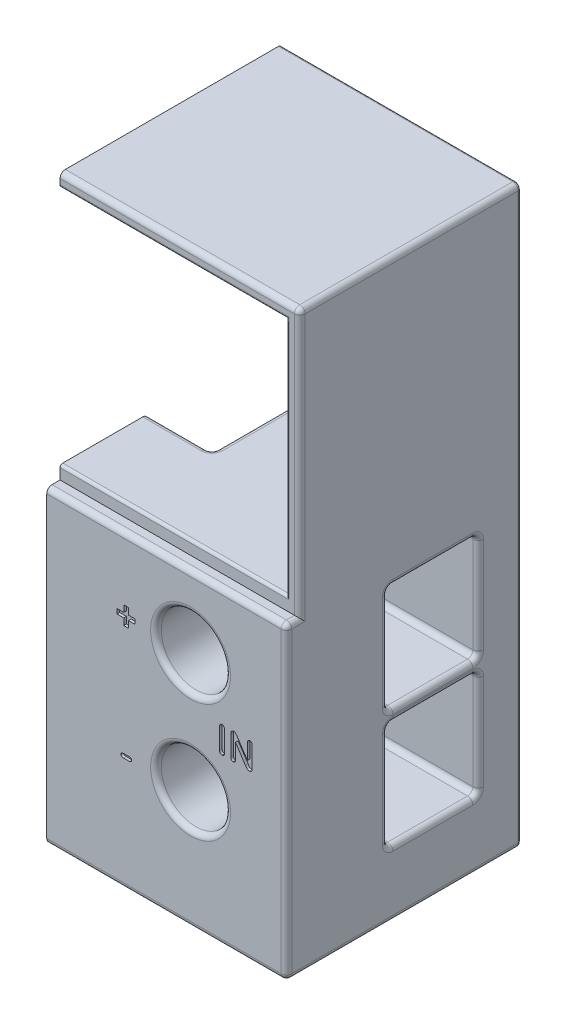
from build123d import *

# Parameters (mm, degrees)
SKETCH2_W               = 87.999717
SKETCH2_H               = 108
SKETCH2_R               = 6.5
SKETCH2_W_2             = 63.5
SKETCH2_H_2             = 21.25
BOSS_EXTRUDE1_DEPTH     = 46
SKETCH4_W               = 63.5
SKETCH4_H               = 21.25
BOSS_EXTRUDE2_DEPTH     = 44
BOSS_EXTRUDE3_START     = -10
SKETCH5_R               = 6.5
BOSS_EXTRUDE3_DEPTH     = 10
BOSS_EXTRUDE4_DEPTH     = 46
CUT_EXTRUDE1_START      = -45
SKETCH3_W               = 2
SKETCH3_H               = 20
CUT_EXTRUDE1_DEPTH      = 28
CUT_EXTRUDE2_START      = 45
SKETCH3_3_W             = 2
SKETCH3_3_H             = 20
CUT_EXTRUDE2_DEPTH      = 28
SKETCH6_W               = 85
SKETCH6_H               = 45
SKETCH6_W_2             = 63.5
SKETCH6_H_2             = 21.25
CUT_EXTRUDE4_DEPTH      = 85.00595217
SKETCH8_R               = 4.25
CUT_EXTRUDE5_DEPTH      = 79.974679487
SKETCH9_W               = 85
SKETCH9_H               = 103
CUT_EXTRUDE6_DEPTH      = 8
SKETCH6_4_W             = 90
SKETCH6_4_H             = 50
SKETCH6_4_W_2           = 85
SKETCH6_4_H_2           = 45
CUT_EXTRUDE7_DEPTH      = 2.5
CUT_EXTRUDE8_DEPTH      = 85.00595217
CUT_EXTRUDE8_DEPTH_BACK = 85.00595217
SKETCH10_W              = 2
SKETCH10_H              = 108
FILLET2_R               = 1
FILLET3_R               = 0.5
SKETCH11_W              = 24
SKETCH11_H              = 58
CUT_EXTRUDE9_DEPTH      = 19
FILLET4_R               = 1
CUT_EXTRUDE10_DEPTH     = 0.5
SKETCH13_W              = 45
SKETCH13_H              = 108
CUT_EXTRUDE12_DEPTH     = 83.927679336


with BuildPart() as part:
    # Sketch2 → Boss-Extrude1 (new body)
    with BuildSketch(Plane.XY):
        Rectangle(SKETCH2_W, SKETCH2_H)
        with Locations((-27, -9.375)):
            Circle(SKETCH2_R, mode=Mode.SUBTRACT)
        with Locations((27, -9.375)):
            Circle(SKETCH2_R, mode=Mode.SUBTRACT)
        with Locations((27, -31.625)):
            Circle(SKETCH2_R, mode=Mode.SUBTRACT)
        with Locations((-27, -31.625)):
            Circle(SKETCH2_R, mode=Mode.SUBTRACT)
        with Locations((0, 32.5)):
            Rectangle(SKETCH2_W_2, SKETCH2_H_2, mode=Mode.SUBTRACT)
    extrude(amount=-BOSS_EXTRUDE1_DEPTH)

    # Sketch4 → Boss-Extrude2 (add)
    with BuildSketch(Plane(origin=(0, 0, -46), x_dir=(-1, 0, 0), z_dir=(0, 0, -1))):
        with Locations((0, 32.5)):
            Rectangle(SKETCH4_W, SKETCH4_H)
    extrude(amount=-BOSS_EXTRUDE2_DEPTH)

    # Sketch5 → Boss-Extrude3 (add)
    with BuildSketch(Plane(origin=(0, 0, -46), x_dir=(-1, 0, 0), z_dir=(0, 0, -1)).offset(BOSS_EXTRUDE3_START)):
        with Locations(Location((-27, -9.375, 0), (0, 0, 180))):
            Circle(SKETCH5_R)
        with Locations(Location((-27, -31.625, 0), (0, 0, 180))):
            Circle(SKETCH5_R)
        with Locations(Location((27, -31.625, 0), (0, 0, 180))):
            Circle(SKETCH5_R)
        with Locations(Location((27, -9.375, 0), (0, 0, 180))):
            Circle(SKETCH5_R)
    extrude(amount=BOSS_EXTRUDE3_DEPTH)

    # Sketch7 → Boss-Extrude4 (add)
    with BuildSketch(Plane.XY):
        Polygon((45, 54), (43.9998585, 52.7998302), (43.9998585, -54), (45, -54), align=None)
        Polygon((-45, 54), (-45, -54), (-43.9998585, -52.7998302), (-43.9998585, 54), align=None)
        Polygon((43.9998585, 54), (43.9998585, 52.7998302), (45, 54), align=None)
        Polygon((-43.9998585, -52.7998302), (-45, -54), (-43.9998585, -54), align=None)
    extrude(amount=-BOSS_EXTRUDE4_DEPTH)

    # Sketch3 → Cut-Extrude1 (cut)
    with BuildSketch(Plane(origin=(0, 0, 0), x_dir=(0, 0, -1), z_dir=(1, 0, 0)).offset(CUT_EXTRUDE1_START)):
        with BuildLine():
            Line((34, -1.125), (34, 0.625))
            Line((34, 0.625), (19, 0.625))
            Line((19, 0.625), (19, -19.375))
            Line((19, -19.375), (34, -19.375))
            Line((34, -19.375), (34, -17.625))
            ThreePointArc((34, -17.625), (27.5, -9.375), (34, -1.125))
        make_face()
        with Locations((35, -9.375)):
            Rectangle(SKETCH3_W, SKETCH3_H)
        with BuildLine():
            Line((34, -21.625), (19, -21.625))
            Line((19, -21.625), (19, -41.625))
            Line((19, -41.625), (34, -41.625))
            Line((34, -41.625), (34, -39.875))
            ThreePointArc((34, -39.875), (27.5, -31.625), (34, -23.375))
            Line((34, -23.375), (34, -21.625))
        make_face()
        with BuildLine():
            Line((34, -39.875), (34, -23.375))
            ThreePointArc((34, -23.375), (27.5, -31.625), (34, -39.875))
        make_face()
        with Locations((35, -31.625)):
            Rectangle(SKETCH3_W, SKETCH3_H)
        with BuildLine():
            Line((34, -17.625), (34, -1.125))
            ThreePointArc((34, -1.125), (27.5, -9.375), (34, -17.625))
        make_face()
    extrude(amount=CUT_EXTRUDE1_DEPTH, mode=Mode.SUBTRACT)

    # Sketch3<3> → Cut-Extrude2 (cut)
    with BuildSketch(Plane(origin=(0, 0, 0), x_dir=(0, 0, -1), z_dir=(1, 0, 0)).offset(CUT_EXTRUDE2_START)):
        with BuildLine():
            Line((34, -1.125), (34, 0.625))
            Line((34, 0.625), (19, 0.625))
            Line((19, 0.625), (19, -19.375))
            Line((19, -19.375), (34, -19.375))
            Line((34, -19.375), (34, -17.625))
            ThreePointArc((34, -17.625), (27.5, -9.375), (34, -1.125))
        make_face()
        with BuildLine():
            Line((34, -17.625), (34, -1.125))
            ThreePointArc((34, -1.125), (27.5, -9.375), (34, -17.625))
        make_face()
        with Locations((35, -9.375)):
            Rectangle(SKETCH3_3_W, SKETCH3_3_H)
        with Locations((35, -31.625)):
            Rectangle(SKETCH3_3_W, SKETCH3_3_H)
        with BuildLine():
            Line((34, -39.875), (34, -23.375))
            ThreePointArc((34, -23.375), (27.5, -31.625), (34, -39.875))
        make_face()
        with BuildLine():
            Line((34, -21.625), (19, -21.625))
            Line((19, -21.625), (19, -41.625))
            Line((19, -41.625), (34, -41.625))
            Line((34, -41.625), (34, -39.875))
            ThreePointArc((34, -39.875), (27.5, -31.625), (34, -23.375))
            Line((34, -23.375), (34, -21.625))
        make_face()
    extrude(amount=-CUT_EXTRUDE2_DEPTH, mode=Mode.SUBTRACT)

    # Sketch6 → Cut-Extrude4 (cut, through all)
    # profile 1 of 2: a face of its own
    with BuildSketch(Plane.XY):
        with Locations((0, 29)):
            Rectangle(SKETCH6_W, SKETCH6_H)
        with Locations((0, 32.5)):
            Rectangle(SKETCH6_W_2, SKETCH6_H_2, mode=Mode.SUBTRACT)
    # profile 2 of 2: a face of its own
    with BuildSketch(Plane.XY):
        with Locations((0, 32.5)):
            Rectangle(SKETCH6_W_2, SKETCH6_H_2)
    extrude(amount=-CUT_EXTRUDE4_DEPTH, mode=Mode.SUBTRACT)

    # Sketch8 → Cut-Extrude5 (cut, through all)
    with BuildSketch(Plane.XY.offset(-36)):
        with Locations((-27, -9.375)):
            Circle(SKETCH8_R)
        with Locations((-27, -31.625)):
            Circle(SKETCH8_R)
        with Locations((27, -31.625)):
            Circle(SKETCH8_R)
        with Locations((27, -9.375)):
            Circle(SKETCH8_R)
    extrude(amount=-CUT_EXTRUDE5_DEPTH, mode=Mode.SUBTRACT)

    # Sketch9 → Cut-Extrude6 (cut)
    with BuildSketch(Plane(origin=(0, 0, -46), x_dir=(-1, 0, 0), z_dir=(0, 0, -1))):
        Rectangle(SKETCH9_W, SKETCH9_H)
    extrude(amount=-CUT_EXTRUDE6_DEPTH, mode=Mode.SUBTRACT)

    # Sketch6<4> → Cut-Extrude7 (cut)
    with BuildSketch(Plane.XY):
        with Locations((0, 29)):
            Rectangle(SKETCH6_4_W, SKETCH6_4_H)
        with Locations((0, 29)):
            Rectangle(SKETCH6_4_W_2, SKETCH6_4_H_2, mode=Mode.SUBTRACT)
    extrude(amount=-CUT_EXTRUDE7_DEPTH, mode=Mode.SUBTRACT)

    # Sketch10 → Cut-Extrude8 (cut, two sides: drawn at the far end of the back side and taken through both)
    with BuildSketch(Plane(origin=(0, 0, 0), x_dir=(0, 0, -1), z_dir=(1, 0, 0)).offset(-CUT_EXTRUDE8_DEPTH_BACK)):
        with Locations((45, 0)):
            Rectangle(SKETCH10_W, SKETCH10_H)
    extrude(amount=CUT_EXTRUDE8_DEPTH + CUT_EXTRUDE8_DEPTH_BACK, mode=Mode.SUBTRACT)

    # Fillet2
    fillet2_edges = [part.edges().sort_by_distance(p)[0] for p in [
        (-17, -31.625, -19),
        (-31, -21.625, -19),
        (-33.5, -31.625, -19),
        (-17, -31.625, -36),
        (-31, -41.625, -36),
        (-17, -41.625, -27.5),
        (-31, -41.625, -19),
        (-45, -21.625, -27.5),
        (-31, -21.625, -36),
        (-17, -21.625, -27.5),
        (-45, -31.625, -19),
        (-45, -31.625, -36),
        (-45, -41.625, -27.5),
        (-45, -9.375, -19),
        (-31, 0.625, -19),
        (-45, -9.375, -36),
        (-31, -19.375, -36),
        (-33.5, -9.375, -19),
        (-17, -19.375, -27.5),
        (-31, -19.375, -19),
        (-45, 0.625, -27.5),
        (-31, 0.625, -36),
        (-17, -9.375, -19),
        (-17, -9.375, -36),
        (-17, 0.625, -27.5),
        (-45, -19.375, -27.5),
        (45, -9.375, -36),
        (31, 0.625, -36),
        (45, -9.375, -19),
        (31, -19.375, -19),
        (17, -19.375, -27.5),
        (31, -19.375, -36),
        (20.5, -9.375, -19),
        (45, 0.625, -27.5),
        (31, 0.625, -19),
        (17, -9.375, -36),
        (17, -9.375, -19),
        (17, 0.625, -27.5),
        (45, -19.375, -27.5),
        (17, -31.625, -19),
        (31, -41.625, -19),
        (20.5, -31.625, -19),
        (17, -31.625, -36),
        (31, -21.625, -36),
        (45, -41.625, -27.5),
        (31, -41.625, -36),
        (17, -21.625, -27.5),
        (31, -21.625, -19),
        (17, -41.625, -27.5),
        (45, -31.625, -36),
        (45, -21.625, -27.5),
        (45, -31.625, -19),
        (0, -54, 0),
        (22.75, -9.375, -36),
        (20.5, -31.625, 0),
        (22.75, -31.625, -36),
        (-31.25, -31.625, -36),
        (-31.25, -9.375, -36),
        (20.5, -9.375, 0),
        (-33.5, -31.625, 0),
        (-33.5, -9.375, 0),
        (0, 6.5, -38),
        (-45, -25, 0),
        (45, -25, 0),
        (-45, 29, -2.5),
        (-45, 4, -1.25),
        (0, 54, -2.5),
        (45, 29, -2.5),
        (45, 4, -1.25),
        (0, 4, 0),
        (-45, -54, -22),
        (45, -54, -22),
        (-45, 54, -23.25),
        (45, 54, -23.25),
    ]]
    fillet(fillet2_edges, radius=FILLET2_R)

    # Fillet3
    fillet3_edges = [part.edges().sort_by_distance(p)[0] for p in [
        (22.75, -31.625, -38),
        (22.75, -9.375, -38),
        (-31.25, -9.375, -38),
        (-31.25, -31.625, -38),
        (0, 51.5, -2.5),
        (-42.5, 29, -2.5),
        (0, 6.5, -2.5),
        (42.5, 29, -2.5),
        (0, -51.5, -44),
        (42.5, 0, -44),
        (0, 51.5, -44),
        (-42.5, 0, -44),
        (-45, 0, -44),
        (45, 0, -44),
        (0, -54, -44),
        (0, 54, -44),
        (44.707106781, 53.707106781, -44),
        (-44.707106781, 53.707106781, -44),
        (-44.707106781, -53.707106781, -44),
        (44.707106781, -53.707106781, -44),
    ]]
    fillet(fillet3_edges, radius=FILLET3_R)

    # Sketch11 → Cut-Extrude9 (cut)
    with BuildSketch(Plane(origin=(0, 0, -38), x_dir=(-1, 0, 0), z_dir=(0, 0, -1))):
        with Locations((0, -22.5)):
            Rectangle(SKETCH11_W, SKETCH11_H)
    extrude(amount=-CUT_EXTRUDE9_DEPTH, mode=Mode.SUBTRACT)

    # Fillet4
    fillet4_edges = [part.edges().sort_by_distance(p)[0] for p in [
        (12, 6.207106781, -37.707106781),
        (-12, 6.207106781, -37.707106781),
        (-12, -23, -38),
        (12, -23, -38),
        (-12, 6.5, -28),
        (12, 6.5, -28),
        (-12, -22.5, -19),
        (0, -51.5, -19),
        (12, -22.5, -19),
        (0, 6.5, -19),
    ]]
    fillet(fillet4_edges, radius=FILLET4_R)

    # Sketch12 → Cut-Extrude10 (cut)
    # profile 1 of 9: a face of its own
    with BuildSketch(Plane.XY):
        with BuildLine():
            add(Edge.make_bspline(
                [(-40.204101563, -18.0625), (-40.142219014, -18.063368709), (-40.020879099, -18.065072082), (-39.842278019, -18.0805127), (-39.670025809, -18.103431299), (-39.504239086, -18.136420072), (-39.345329126, -18.179465633), (-39.193265668, -18.232369375), (-39.047852761, -18.294956068), (-38.908920342, -18.365997783), (-38.77799459, -18.446416769), (-38.654241911, -18.534359089), (-38.539064026, -18.631114909), (-38.43219245, -18.735834907), (-38.334309043, -18.848804815), (-38.243990785, -18.969397378), (-38.161933411, -19.098290949), (-38.089020705, -19.23545814), (-38.023513565, -19.378849399), (-37.966648985, -19.528884986), (-37.919187553, -19.684929266), (-37.879709879, -19.847240726), (-37.849789796, -20.015581804), (-37.828714559, -20.190346757), (-37.81412411, -20.370846257), (-37.813046628, -20.493459783), (-37.8125, -20.555664063)],
                knots=[0, 0, 0, 0, 1.137132438, 2.22970057, 3.292424762, 4.329649132, 5.333981859, 6.315987487, 7.286185149, 8.241436353, 9.181332131, 10.107725602, 11.0292572, 11.943085262, 12.854854597, 13.773819033, 14.709898734, 15.660115542, 16.626635295, 17.605574315, 18.606712189, 19.622473761, 20.67399022, 21.747038223, 22.857027702, 24, 24, 24, 24], degree=3))
            add(Edge.make_bspline(
                [(-37.8125, -20.555664063), (-37.814407642, -20.646879139), (-37.818150658, -20.825853777), (-37.846542647, -21.087869401), (-37.894672643, -21.337285549), (-37.96022212, -21.574001048), (-38.046378281, -21.796377097), (-38.151196568, -22.00412166), (-38.275708195, -22.196231979), (-38.418571732, -22.372534386), (-38.57924091, -22.5320302), (-38.758813404, -22.671073825), (-38.956175636, -22.789747841), (-39.169574475, -22.889709328), (-39.400288076, -22.968467406), (-39.647849295, -23.021416856), (-39.910729065, -23.057454879), (-40.09166815, -23.060788415), (-40.184570313, -23.0625)],
                knots=[0, 0, 0, 0, 1.119700056, 2.196982321, 3.230778928, 4.235358115, 5.208318876, 6.153781848, 7.087131445, 8.013361148, 8.934611457, 9.860297843, 10.794468433, 11.756326826, 12.748403726, 13.780058436, 14.860183413, 16, 16, 16, 16], degree=3))
            add(Edge.make_bspline(
                [(-40.184570313, -23.0625), (-40.276803124, -23.06027942), (-40.457365589, -23.055932231), (-40.720582827, -23.021097135), (-40.969461773, -22.965059913), (-41.20258146, -22.884937151), (-41.418313513, -22.78290435), (-41.617562497, -22.664138614), (-41.796462748, -22.523837845), (-41.957312206, -22.366006832), (-42.100098053, -22.190396648), (-42.221488428, -21.996136894), (-42.328544833, -21.787455566), (-42.413165738, -21.561257329), (-42.480490707, -21.32244949), (-42.5279401, -21.072812122), (-42.556870777, -20.813835192), (-42.56060378, -20.638096536), (-42.5625, -20.548828125)],
                knots=[0, 0, 0, 0, 1.130091603, 2.212359386, 3.247930852, 4.252250901, 5.226719473, 6.16821431, 7.089197795, 8.00610207, 8.925165125, 9.855999165, 10.808795857, 11.79501972, 12.810514548, 13.846493258, 14.906102224, 16, 16, 16, 16], degree=3))
            add(Edge.make_bspline(
                [(-42.5625, -20.548828125), (-42.560779931, -20.457917793), (-42.557397661, -20.279155552), (-42.52617064, -20.017250939), (-42.476867474, -19.76650569), (-42.406593898, -19.528182138), (-42.317493046, -19.303954514), (-42.20934334, -19.096268157), (-42.084128705, -18.905766816), (-41.941020547, -18.732813051), (-41.779791607, -18.578459843), (-41.601343885, -18.443470626), (-41.406555768, -18.327351299), (-41.195418304, -18.231841316), (-40.968892091, -18.155181952), (-40.727036042, -18.101058131), (-40.470304863, -18.068269124), (-40.294370818, -18.064456304), (-40.204101563, -18.0625)],
                knots=[0, 0, 0, 0, 1.125218611, 2.212582392, 3.260701818, 4.286054269, 5.284468473, 6.243521648, 7.180287843, 8.101949555, 9.017004541, 9.937572836, 10.866572707, 11.818894766, 12.801573564, 13.82236102, 14.882684417, 16, 16, 16, 16], degree=3))
        make_face()
        with BuildLine():
            add(Edge.make_bspline(
                [(-38.8125, -20.548828125), (-38.814409711, -20.461806319), (-38.818107355, -20.293311934), (-38.850878723, -20.049572404), (-38.903958219, -19.823491976), (-38.967222357, -19.648437478), (-39.027971578, -19.51867883), (-39.077585349, -19.428366426), (-39.130955162, -19.343341598), (-39.191528722, -19.266437061), (-39.254362066, -19.193984208), (-39.322390378, -19.127691549), (-39.395732164, -19.068546163), (-39.498508546, -18.996758293), (-39.636913927, -18.922373447), (-39.815617192, -18.858633433), (-40.006108222, -18.819354309), (-40.137179526, -18.814816767), (-40.204101563, -18.8125)],
                knots=[0, 0, 0, 0, 1.663767962, 3.22144036, 4.693807908, 6.09809827, 6.772124886, 7.43249818, 8.068074837, 8.689496673, 9.30272399, 9.901527182, 10.503429657, 11.102750509, 12.297797107, 13.495176895, 14.721094103, 16, 16, 16, 16], degree=3))
            add(Edge.make_bspline(
                [(-40.204101563, -18.8125), (-40.252038776, -18.813692449), (-40.346782105, -18.816049209), (-40.485861893, -18.838431131), (-40.619461179, -18.87343406), (-40.746958383, -18.922391316), (-40.86721804, -18.984912243), (-40.979702156, -19.060816842), (-41.083054339, -19.149809619), (-41.177853092, -19.25153021), (-41.263531901, -19.367003595), (-41.339544956, -19.497427585), (-41.40577496, -19.642803935), (-41.462238579, -19.801835484), (-41.506895778, -19.973704465), (-41.538649307, -20.156608918), (-41.558596828, -20.349495293), (-41.561179593, -20.481395653), (-41.5625, -20.548828125)],
                knots=[0, 0, 0, 0, 0.926902171, 1.831933723, 2.71800685, 3.595261319, 4.468550136, 5.334998465, 6.214894287, 7.1017058, 8.020008637, 8.99111482, 10.01694856, 11.106630737, 12.25237115, 13.448355624, 14.695502513, 16, 16, 16, 16], degree=3))
            add(Edge.make_bspline(
                [(-41.5625, -20.548828125), (-41.561175948, -20.616910417), (-41.558585554, -20.750107531), (-41.538678745, -20.94495126), (-41.506717933, -21.130076126), (-41.462379635, -21.304715937), (-41.405018449, -21.466834698), (-41.336159513, -21.614946915), (-41.258965571, -21.750109054), (-41.167899319, -21.868552345), (-41.069532555, -21.973072777), (-40.963817326, -22.06410939), (-40.851516456, -22.141662991), (-40.731554552, -22.204799085), (-40.604589267, -22.252170855), (-40.472024127, -22.288072541), (-40.332998529, -22.308578568), (-40.238345748, -22.311182043), (-40.190429688, -22.3125)],
                knots=[0, 0, 0, 0, 1.300369924, 2.54406124, 3.737115199, 4.88637188, 5.981883645, 7.016846829, 8.003376514, 8.948590554, 9.863559023, 10.741055788, 11.608647785, 12.46534091, 13.323432129, 14.192248925, 15.0848625, 16, 16, 16, 16], degree=3))
            add(Edge.make_bspline(
                [(-40.190429688, -22.3125), (-40.128714879, -22.310432989), (-40.007115757, -22.306360277), (-39.829062488, -22.268333598), (-39.65894479, -22.208545464), (-39.524248456, -22.139704674), (-39.422731166, -22.071892244), (-39.349371171, -22.014681888), (-39.281172171, -21.949579237), (-39.216166088, -21.879097392), (-39.155929432, -21.801699497), (-39.098897641, -21.718367101), (-39.046241602, -21.628209325), (-38.997525615, -21.53173024), (-38.95353172, -21.42910536), (-38.915158866, -21.320607226), (-38.884568811, -21.205758865), (-38.857870644, -21.085626874), (-38.837560064, -20.959421065), (-38.823117244, -20.827745953), (-38.814067885, -20.690231108), (-38.81303074, -20.596694032), (-38.8125, -20.548828125)],
                knots=[0, 0, 0, 0, 1.468568495, 2.893578421, 4.316075305, 5.755382189, 6.482330971, 7.222315454, 7.968369796, 8.725783183, 9.504530818, 10.302500265, 11.129737207, 11.9897977, 12.875655565, 13.787998707, 14.728608307, 15.705132475, 16.718642732, 17.771954593, 18.859838044, 20, 20, 20, 20], degree=3))
        make_face(mode=Mode.SUBTRACT)
    # profile 2 of 9: a face of its own
    with BuildSketch(Plane.XY):
        with BuildLine():
            Line((-36.9375, -20.981445313), (-36.9375, -18.65625))
            add(Edge.make_bspline(
                [(-36.9375, -18.65625), (-36.936347915, -18.609560537), (-36.934186191, -18.521954458), (-36.909347602, -18.399701183), (-36.870478375, -18.295100271), (-36.81330714, -18.209823291), (-36.743514772, -18.143210616), (-36.661901868, -18.096558932), (-36.571075194, -18.066512432), (-36.506755039, -18.06386389), (-36.473632813, -18.0625)],
                knots=[0, 0, 0, 0, 1.314006093, 2.465543923, 3.499702682, 4.438645347, 5.334276599, 6.193453487, 7.069703068, 8, 8, 8, 8], degree=3))
            add(Edge.make_bspline(
                [(-36.473632813, -18.0625), (-36.438939423, -18.064363054), (-36.372286212, -18.067942368), (-36.277450995, -18.095840638), (-36.194605213, -18.143871779), (-36.123835804, -18.210848219), (-36.067342536, -18.296948281), (-36.027775176, -18.402193177), (-36.003534117, -18.525270354), (-36.001222859, -18.613483661), (-36, -18.66015625)],
                knots=[0, 0, 0, 0, 0.96282878, 1.849794185, 2.716851436, 3.599658085, 4.532680285, 5.552030856, 6.704809248, 8, 8, 8, 8], degree=3))
            Line((-36, -18.66015625), (-36, -21.053710938))
            add(Edge.make_bspline(
                [(-36, -21.053710938), (-35.99889066, -21.119176272), (-35.996767426, -21.244474345), (-35.980352355, -21.424389171), (-35.952620356, -21.587521133), (-35.913468807, -21.734879035), (-35.858654871, -21.866513437), (-35.785781742, -21.982442862), (-35.694423845, -22.082436057), (-35.604389303, -22.152348162), (-35.523320188, -22.198607116), (-35.455881093, -22.22899436), (-35.38297238, -22.255675736), (-35.303537405, -22.275251537), (-35.21924944, -22.292442399), (-35.128794967, -22.303466192), (-35.032714084, -22.312002141), (-34.966492651, -22.312331511), (-34.932617188, -22.3125)],
                knots=[0, 0, 0, 0, 1.640841622, 3.140506311, 4.523579023, 5.784571649, 6.954579444, 8.084197464, 9.198982671, 10.333306227, 10.925380769, 11.535182691, 12.185613052, 12.868404783, 13.583722754, 14.340779317, 15.151228418, 16, 16, 16, 16], degree=3))
            add(Edge.make_bspline(
                [(-34.932617188, -22.3125), (-34.886018292, -22.311674313), (-34.796154634, -22.310082015), (-34.666915353, -22.294831437), (-34.547810982, -22.27254376), (-34.439976213, -22.237904472), (-34.342004443, -22.195029342), (-34.254772573, -22.142425249), (-34.177901824, -22.079862251), (-34.111987738, -22.006889167), (-34.056360614, -21.923270422), (-34.007144985, -21.831202928), (-33.966579922, -21.728768874), (-33.932253732, -21.61717405), (-33.906095076, -21.495290392), (-33.887966427, -21.363741724), (-33.877290695, -21.222181646), (-33.875781426, -21.124693418), (-33.875, -21.07421875)],
                knots=[0, 0, 0, 0, 1.187087794, 2.289239917, 3.312641325, 4.270309596, 5.169103343, 6.032749862, 6.858132282, 7.686303516, 8.528484611, 9.411791075, 10.342302716, 11.33164497, 12.384483705, 13.515514569, 14.713654137, 16, 16, 16, 16], degree=3))
            Line((-33.875, -21.07421875), (-33.875, -18.66015625))
            add(Edge.make_bspline(
                [(-33.875, -18.66015625), (-33.873685282, -18.612853927), (-33.871218239, -18.524091977), (-33.848475161, -18.400133957), (-33.808724112, -18.295398446), (-33.752835216, -18.209945927), (-33.683718699, -18.142612396), (-33.601499713, -18.096857609), (-33.509937038, -18.066252371), (-33.444926434, -18.063783409), (-33.411132813, -18.0625)],
                knots=[0, 0, 0, 0, 1.324209478, 2.484855026, 3.512713035, 4.440887327, 5.324452051, 6.186293477, 7.057204391, 8, 8, 8, 8], degree=3))
            add(Edge.make_bspline(
                [(-33.411132813, -18.0625), (-33.377364158, -18.063865071), (-33.311778592, -18.066516314), (-33.21904633, -18.096543029), (-33.135875484, -18.142868959), (-33.064442019, -18.209061932), (-33.00544498, -18.293736648), (-32.965148551, -18.399135464), (-32.941017171, -18.522664676), (-32.938719595, -18.611204538), (-32.9375, -18.658203125)],
                knots=[0, 0, 0, 0, 0.937671153, 1.821147261, 2.686184232, 3.571984669, 4.510357278, 5.535961965, 6.692043289, 8, 8, 8, 8], degree=3))
            Line((-32.9375, -18.658203125), (-32.9375, -20.9921875))
            add(Edge.make_bspline(
                [(-32.9375, -20.9921875), (-32.938814946, -21.083039659), (-32.941339732, -21.257482084), (-32.960267279, -21.507426996), (-32.993362685, -21.733860143), (-33.038094829, -21.939597905), (-33.102992598, -22.128276032), (-33.192235417, -22.30285969), (-33.3043956, -22.466365378), (-33.396080085, -22.562684701), (-33.442382813, -22.611328125)],
                knots=[0, 0, 0, 0, 1.248457049, 2.397123805, 3.441600438, 4.391152342, 5.286682789, 6.174943873, 7.078305605, 8, 8, 8, 8], degree=3))
            add(Edge.make_bspline(
                [(-33.442382813, -22.611328125), (-33.486816817, -22.648867023), (-33.575580817, -22.72385695), (-33.723495667, -22.817039267), (-33.880907486, -22.896203445), (-34.049981491, -22.958697173), (-34.231695061, -23.005474425), (-34.42711508, -23.037961431), (-34.636914453, -23.058930849), (-34.781848334, -23.061287196), (-34.856445313, -23.0625)],
                knots=[0, 0, 0, 0, 0.917673777, 1.83319953, 2.752815171, 3.696261941, 4.673826777, 5.7116717, 6.822205161, 8, 8, 8, 8], degree=3))
            add(Edge.make_bspline(
                [(-34.856445313, -23.0625), (-34.945041021, -23.061054572), (-35.11602359, -23.058265014), (-35.362992947, -23.035453679), (-35.59115974, -22.999491216), (-35.80038398, -22.946707796), (-35.991758558, -22.879304535), (-36.163349314, -22.792178873), (-36.319002206, -22.691987195), (-36.454850533, -22.572271952), (-36.573259477, -22.435920236), (-36.674960776, -22.282188342), (-36.757035815, -22.109682213), (-36.825457088, -21.920505185), (-36.87453983, -21.712198793), (-36.912072948, -21.485854188), (-36.932824061, -21.239967141), (-36.93590376, -21.069697737), (-36.9375, -20.981445313)],
                knots=[0, 0, 0, 0, 1.244583114, 2.401944964, 3.48169555, 4.486712429, 5.430003149, 6.325898902, 7.184706889, 8.024138875, 8.860562605, 9.715550095, 10.605366032, 11.538500779, 12.536866304, 13.60758979, 14.759988597, 16, 16, 16, 16], degree=3))
        make_face()
    # profile 3 of 9: a face of its own
    with BuildSketch(Plane.XY):
        with BuildLine():
            Line((-28.745117188, -19), (-29.8125, -19))
            Line((-29.8125, -19), (-29.8125, -22.47265625))
            add(Edge.make_bspline(
                [(-29.8125, -22.47265625), (-29.813657073, -22.519665199), (-29.815821135, -22.607585544), (-29.840444898, -22.730371911), (-29.880326392, -22.834692417), (-29.938406433, -22.918913784), (-30.008809833, -22.983769579), (-30.090108837, -23.029549039), (-30.181052362, -23.058224996), (-30.24522422, -23.0610454), (-30.278320313, -23.0625)],
                knots=[0, 0, 0, 0, 1.324771526, 2.4777063, 3.516495944, 4.454151167, 5.338361256, 6.19400724, 7.068574513, 8, 8, 8, 8], degree=3))
            add(Edge.make_bspline(
                [(-30.278320313, -23.0625), (-30.311785823, -23.061172111), (-30.376777519, -23.058593283), (-30.468397513, -23.028011397), (-30.551928478, -22.98331378), (-30.622940466, -22.916801763), (-30.682108754, -22.832713736), (-30.72067972, -22.727778171), (-30.746982853, -22.606447162), (-30.748953809, -22.519048027), (-30.75, -22.47265625)],
                knots=[0, 0, 0, 0, 0.936591527, 1.818907611, 2.686883908, 3.580272073, 4.52668274, 5.549195867, 6.699104295, 8, 8, 8, 8], degree=3))
            Line((-30.75, -22.47265625), (-30.75, -19))
            Line((-30.75, -19), (-31.818359375, -19))
            add(Edge.make_bspline(
                [(-31.818359375, -19), (-31.857558989, -18.999027325), (-31.931105492, -18.997202388), (-32.033183239, -18.975092322), (-32.120787236, -18.941882109), (-32.191671431, -18.891924127), (-32.245912788, -18.830486748), (-32.285529969, -18.760081709), (-32.308075229, -18.680390244), (-32.310996015, -18.624488378), (-32.3125, -18.595703125)],
                knots=[0, 0, 0, 0, 1.298175259, 2.435642608, 3.448405227, 4.386245553, 5.281324188, 6.14672195, 7.045701294, 8, 8, 8, 8], degree=3))
            add(Edge.make_bspline(
                [(-32.3125, -18.595703125), (-32.311247918, -18.565554112), (-32.308833523, -18.507417629), (-32.283329306, -18.425945796), (-32.243636614, -18.353897492), (-32.186560863, -18.293822576), (-32.114862047, -18.245009031), (-32.028070201, -18.211391908), (-31.927722451, -18.190746532), (-31.856231461, -18.188624264), (-31.818359375, -18.1875)],
                knots=[0, 0, 0, 0, 0.993926626, 1.916593339, 2.793690024, 3.692250099, 4.629614642, 5.63892321, 6.749228366, 8, 8, 8, 8], degree=3))
            Line((-31.818359375, -18.1875), (-28.745117188, -18.1875))
            add(Edge.make_bspline(
                [(-28.745117188, -18.1875), (-28.705275506, -18.188508285), (-28.630456794, -18.190401743), (-28.52655638, -18.212087944), (-28.437800612, -18.246313023), (-28.367301212, -18.297922779), (-28.311178966, -18.358681581), (-28.272670556, -18.430396477), (-28.248088606, -18.510125573), (-28.245485907, -18.566542407), (-28.244140625, -18.595703125)],
                knots=[0, 0, 0, 0, 1.304496451, 2.449714448, 3.464685333, 4.39788137, 5.28974218, 6.154486031, 7.046091257, 8, 8, 8, 8], degree=3))
            add(Edge.make_bspline(
                [(-28.244140625, -18.595703125), (-28.245556319, -18.624509871), (-28.248310157, -18.680545355), (-28.272174801, -18.760180811), (-28.312729287, -18.830547282), (-28.367969961, -18.89196525), (-28.439818128, -18.94187864), (-28.528657631, -18.975240046), (-28.631760922, -18.997026322), (-28.705927235, -18.998971929), (-28.745117188, -19)],
                knots=[0, 0, 0, 0, 0.94771637, 1.843517728, 2.708217129, 3.604275273, 4.544436114, 5.560171289, 6.710778986, 8, 8, 8, 8], degree=3))
        make_face()
    # profile 4 of 9: a face of its own
    with BuildSketch(Plane.XY):
        with BuildLine():
            Line((32.4375, -22.465820313), (32.4375, -18.65625))
            add(Edge.make_bspline(
                [(32.4375, -18.65625), (32.438643547, -18.609554715), (32.440789249, -18.521937711), (32.465733108, -18.39975622), (32.504325843, -18.294751077), (32.562775756, -18.210113201), (32.632401848, -18.143169865), (32.714091115, -18.096570131), (32.804584088, -18.066611246), (32.868573218, -18.063893054), (32.901367187, -18.0625)],
                knots=[0, 0, 0, 0, 1.314663, 2.466776515, 3.501452278, 4.446007437, 5.34208644, 6.201692853, 7.078380494, 8, 8, 8, 8], degree=3))
            add(Edge.make_bspline(
                [(32.901367187, -18.0625), (32.935135716, -18.063865122), (33.000721037, -18.066516466), (33.093455042, -18.096542467), (33.17661943, -18.142871041), (33.248077981, -18.209053741), (33.306798442, -18.293520353), (33.34741112, -18.398101806), (33.371534885, -18.521032872), (33.373795616, -18.609252046), (33.375, -18.65625)],
                knots=[0, 0, 0, 0, 0.939704012, 1.825095485, 2.692007845, 3.579728686, 4.520135675, 5.539530793, 6.689207656, 8, 8, 8, 8], degree=3))
            Line((33.375, -18.65625), (33.375, -22.465820313))
            add(Edge.make_bspline(
                [(33.375, -22.465820313), (33.373805235, -22.512819272), (33.37156256, -22.601040335), (33.347261779, -22.724256909), (33.306749817, -22.82939308), (33.248449526, -22.91498494), (33.176278301, -22.980853961), (33.093956455, -23.029009161), (33.000432773, -23.056885259), (32.935079764, -23.060589272), (32.901367187, -23.0625)],
                knots=[0, 0, 0, 0, 1.307751878, 2.454761992, 3.480206064, 4.425894871, 5.311556588, 6.180961951, 7.061642901, 8, 8, 8, 8], degree=3))
            add(Edge.make_bspline(
                [(32.901367187, -23.0625), (32.868958253, -23.060558866), (32.805849946, -23.056778993), (32.715428305, -23.029033521), (32.635454587, -22.979972006), (32.56442116, -22.9140444), (32.505147213, -22.828460081), (32.467193553, -22.722447896), (32.440376435, -22.600287941), (32.438499535, -22.512546578), (32.4375, -22.465820313)],
                knots=[0, 0, 0, 0, 0.912572231, 1.777006537, 2.632638816, 3.534642503, 4.491136576, 5.533474522, 6.686463005, 8, 8, 8, 8], degree=3))
        make_face()
    # profile 5 of 9: a face of its own
    with BuildSketch(Plane.XY):
        with BuildLine():
            Line((35.787109375, -18.649414063), (37.6875, -21.5))
            Line((37.6875, -21.5), (37.6875, -18.623046875))
            add(Edge.make_bspline(
                [(37.6875, -18.623046875), (37.688967089, -18.579010182), (37.691715012, -18.496527494), (37.712591005, -18.380878978), (37.74917017, -18.282776521), (37.801005478, -18.20221468), (37.865452464, -18.139204827), (37.941547557, -18.094442008), (38.027794079, -18.067009974), (38.088659627, -18.064036698), (38.120117188, -18.0625)],
                knots=[0, 0, 0, 0, 1.319117216, 2.470765316, 3.505116792, 4.43580569, 5.318756254, 6.18027265, 7.059497782, 8, 8, 8, 8], degree=3))
            add(Edge.make_bspline(
                [(38.120117188, -18.0625), (38.152531882, -18.064065554), (38.215273445, -18.067095825), (38.304001596, -18.093969467), (38.381550309, -18.139196897), (38.447017136, -18.202122215), (38.499797352, -18.28268682), (38.537660955, -18.380669347), (38.558201659, -18.496555875), (38.561003907, -18.57902006), (38.5625, -18.623046875)],
                knots=[0, 0, 0, 0, 0.959871134, 1.857917088, 2.719075999, 3.600089629, 4.526699118, 5.554128738, 6.694173474, 8, 8, 8, 8], degree=3))
            Line((38.5625, -18.623046875), (38.5625, -22.42578125))
            add(Edge.make_bspline(
                [(38.5625, -22.42578125), (38.561293623, -22.475696837), (38.559029392, -22.569382615), (38.534906572, -22.700379865), (38.494225141, -22.811882756), (38.437305638, -22.904397618), (38.362391295, -22.976980916), (38.269778573, -23.026870963), (38.161798711, -23.058030745), (38.084539552, -23.060960579), (38.043945312, -23.0625)],
                knots=[0, 0, 0, 0, 1.276164049, 2.395212213, 3.391561633, 4.297456637, 5.151673506, 6.027862746, 6.963780962, 8, 8, 8, 8], degree=3))
            add(Edge.make_bspline(
                [(38.043945312, -23.0625), (38.002789087, -23.060568961), (37.923409742, -23.056844502), (37.809055553, -23.02965263), (37.705082087, -22.978923283), (37.611659905, -22.90557179), (37.524201899, -22.816608833), (37.444148006, -22.713420226), (37.368725794, -22.601624608), (37.31710543, -22.526334263), (37.291015625, -22.48828125)],
                knots=[0, 0, 0, 0, 0.990229924, 1.909888509, 2.806876858, 3.75171819, 4.754420985, 5.802993103, 6.889595585, 8, 8, 8, 8], degree=3))
            Line((37.291015625, -22.48828125), (35.4375, -19.6875))
            Line((35.4375, -19.6875), (35.4375, -22.504882813))
            add(Edge.make_bspline(
                [(35.4375, -22.504882813), (35.436036307, -22.547938792), (35.433263701, -22.629497779), (35.411855241, -22.744183748), (35.372471416, -22.842106499), (35.318360969, -22.922634501), (35.251913254, -22.985290653), (35.175949163, -23.030398667), (35.090705587, -23.057908316), (35.030805512, -23.060940568), (35, -23.0625)],
                knots=[0, 0, 0, 0, 1.293064309, 2.449392962, 3.484384031, 4.441729672, 5.340986808, 6.204611779, 7.076664708, 8, 8, 8, 8], degree=3))
            add(Edge.make_bspline(
                [(35, -23.0625), (34.968539892, -23.060998934), (34.907259618, -23.058075048), (34.820516547, -23.029815038), (34.744224961, -22.983177012), (34.677600434, -22.920167138), (34.625760233, -22.838120196), (34.588733065, -22.740192856), (34.566493997, -22.626306887), (34.563883519, -22.545029234), (34.5625, -22.501953125)],
                knots=[0, 0, 0, 0, 0.938889884, 1.828837584, 2.693878765, 3.596100726, 4.546832571, 5.570326044, 6.712304089, 8, 8, 8, 8], degree=3))
            Line((34.5625, -22.501953125), (34.5625, -18.771484375))
            add(Edge.make_bspline(
                [(34.5625, -18.771484375), (34.562866376, -18.734013867), (34.563559158, -18.663160664), (34.573805999, -18.563394484), (34.587808296, -18.4755907), (34.60516579, -18.423017833), (34.61328125, -18.3984375)],
                knots=[0, 0, 0, 0, 1.18793306, 2.246269525, 3.180047019, 4, 4, 4, 4], degree=3))
            add(Edge.make_bspline(
                [(34.61328125, -18.3984375), (34.624171136, -18.374519786), (34.645912187, -18.326769403), (34.693585215, -18.263498293), (34.747997085, -18.204529475), (34.81366266, -18.15594809), (34.884514081, -18.114658781), (34.959655854, -18.084142498), (35.038189814, -18.06582318), (35.09137625, -18.063613118), (35.118164062, -18.0625)],
                knots=[0, 0, 0, 0, 0.980600708, 1.957714689, 2.948627098, 3.97434472, 5.000279326, 6.011426356, 6.998437519, 8, 8, 8, 8], degree=3))
            add(Edge.make_bspline(
                [(35.118164062, -18.0625), (35.158192841, -18.064092522), (35.233254113, -18.067078791), (35.336754319, -18.101647792), (35.424863608, -18.152322857), (35.501056635, -18.221492432), (35.57309913, -18.30697701), (35.639869357, -18.412366203), (35.71217371, -18.52814521), (35.761749808, -18.608374517), (35.787109375, -18.649414063)],
                knots=[0, 0, 0, 0, 1.01695463, 1.906975685, 2.751376853, 3.592506721, 4.517315556, 5.594915983, 6.76973195, 8, 8, 8, 8], degree=3))
        make_face()
    # profile 6 of 9: a face of its own
    with BuildSketch(Plane.XY):
        Polygon((-14.522682188, -11.1875), (-15.397682188, -11.1875), (-15.397682188, -9.9375), (-16.659400938, -9.9375), (-16.659400938, -9.0625), (-15.397682188, -9.0625), (-15.397682188, -7.8125), (-14.522682188, -7.8125), (-14.522682188, -9.0625), (-13.254127501, -9.0625), (-13.254127501, -9.9375), (-14.522682188, -9.9375), align=None)
    # profile 7 of 9: a face of its own
    with BuildSketch(Plane.XY):
        with BuildLine():
            Line((-14.411354063, -32.75), (-15.446510313, -32.75))
            add(Edge.make_bspline(
                [(-15.446510313, -32.75), (-15.483728445, -32.748810461), (-15.553858549, -32.746569012), (-15.652051779, -32.726862015), (-15.737118614, -32.695546818), (-15.806313483, -32.648619181), (-15.86133667, -32.592575907), (-15.900186363, -32.527200376), (-15.924812703, -32.454512589), (-15.927538485, -32.40319303), (-15.928932188, -32.376953125)],
                knots=[0, 0, 0, 0, 1.299805928, 2.449223535, 3.486898841, 4.446433637, 5.347856832, 6.21051608, 7.085029387, 8, 8, 8, 8], degree=3))
            add(Edge.make_bspline(
                [(-15.928932188, -32.376953125), (-15.927460116, -32.350098037), (-15.924603475, -32.297984181), (-15.901588947, -32.224026731), (-15.862967144, -32.158771421), (-15.810688995, -32.101085092), (-15.741489649, -32.054068505), (-15.655917148, -32.02320672), (-15.556143428, -32.003290066), (-15.484709054, -32.001146336), (-15.446510313, -32)],
                knots=[0, 0, 0, 0, 0.930252909, 1.805209739, 2.655335837, 3.542447437, 4.485088836, 5.525143206, 6.676597728, 8, 8, 8, 8], degree=3))
            Line((-15.446510313, -32), (-14.411354063, -32))
            add(Edge.make_bspline(
                [(-14.411354063, -32), (-14.37315931, -32.00116056), (-14.301732394, -32.003330891), (-14.202208993, -32.023014209), (-14.117064493, -32.05426825), (-14.048176823, -32.101390906), (-13.994841642, -32.158426744), (-13.95632081, -32.224067988), (-13.933248571, -32.297972971), (-13.930400067, -32.350094225), (-13.928932188, -32.376953125)],
                knots=[0, 0, 0, 0, 1.32387857, 2.475747504, 3.505638844, 4.448619502, 5.343708498, 6.194140559, 7.06941229, 8, 8, 8, 8], degree=3))
            add(Edge.make_bspline(
                [(-13.928932188, -32.376953125), (-13.930522006, -32.40313267), (-13.933619461, -32.454138491), (-13.955309123, -32.527336339), (-13.993686647, -32.592136376), (-14.046549584, -32.648917181), (-14.11513059, -32.695708593), (-14.200543891, -32.727144105), (-14.30077577, -32.746629169), (-14.372838742, -32.748825912), (-14.411354063, -32.75)],
                knots=[0, 0, 0, 0, 0.911547891, 1.775976195, 2.629630521, 3.512087315, 4.458640903, 5.492434473, 6.659787555, 8, 8, 8, 8], degree=3))
        make_face()
    # profile 8 of 9: a face of its own
    with BuildSketch(Plane.XY):
        Polygon((15.335182188, -11.1875), (14.460182188, -11.1875), (14.460182188, -9.9375), (13.198463438, -9.9375), (13.198463438, -9.0625), (14.460182188, -9.0625), (14.460182188, -7.8125), (15.335182188, -7.8125), (15.335182188, -9.0625), (16.603736876, -9.0625), (16.603736876, -9.9375), (15.335182188, -9.9375), align=None)
    # profile 9 of 9: a face of its own
    with BuildSketch(Plane.XY):
        with BuildLine():
            Line((15.446510313, -32.75), (14.411354063, -32.75))
            add(Edge.make_bspline(
                [(14.411354063, -32.75), (14.374135931, -32.748810461), (14.304005827, -32.746569012), (14.205812598, -32.726862015), (14.120745762, -32.695546818), (14.051550893, -32.648619181), (13.996527706, -32.592575907), (13.957678013, -32.527200376), (13.933051673, -32.454512589), (13.930325892, -32.40319303), (13.928932188, -32.376953125)],
                knots=[0, 0, 0, 0, 1.299805928, 2.449223535, 3.486898841, 4.446433637, 5.347856832, 6.21051608, 7.085029387, 8, 8, 8, 8], degree=3))
            add(Edge.make_bspline(
                [(13.928932188, -32.376953125), (13.93040426, -32.350098037), (13.933260901, -32.297984181), (13.956275429, -32.224026731), (13.994897232, -32.158771421), (14.047175382, -32.101085092), (14.116374727, -32.054068505), (14.201947229, -32.02320672), (14.301720948, -32.003290066), (14.373155322, -32.001146336), (14.411354063, -32)],
                knots=[0, 0, 0, 0, 0.930252909, 1.805209739, 2.655335837, 3.542447437, 4.485088836, 5.525143206, 6.676597728, 8, 8, 8, 8], degree=3))
            Line((14.411354063, -32), (15.446510313, -32))
            add(Edge.make_bspline(
                [(15.446510313, -32), (15.484705066, -32.00116056), (15.556131982, -32.003330891), (15.655655383, -32.023014209), (15.740799883, -32.05426825), (15.809687553, -32.101390906), (15.863022734, -32.158426744), (15.901543566, -32.224067988), (15.924615806, -32.297972971), (15.927464309, -32.350094225), (15.928932188, -32.376953125)],
                knots=[0, 0, 0, 0, 1.32387857, 2.475747504, 3.505638844, 4.448619502, 5.343708498, 6.194140559, 7.06941229, 8, 8, 8, 8], degree=3))
            add(Edge.make_bspline(
                [(15.928932188, -32.376953125), (15.92734237, -32.40313267), (15.924244915, -32.454138491), (15.902555253, -32.527336339), (15.864177729, -32.592136376), (15.811314792, -32.648917181), (15.742733786, -32.695708593), (15.657320485, -32.727144105), (15.557088606, -32.746629169), (15.485025634, -32.748825912), (15.446510313, -32.75)],
                knots=[0, 0, 0, 0, 0.911547891, 1.775976195, 2.629630521, 3.512087315, 4.458640903, 5.492434473, 6.659787555, 8, 8, 8, 8], degree=3))
        make_face()
    extrude(amount=-CUT_EXTRUDE10_DEPTH, mode=Mode.SUBTRACT)

    # Sketch13 → Cut-Extrude12 (cut, through all)
    with BuildSketch(Plane.XY):
        with Locations((-22.5, 0)):
            Rectangle(SKETCH13_W, SKETCH13_H)
    extrude(amount=-CUT_EXTRUDE12_DEPTH, mode=Mode.SUBTRACT)


solid = part.part
